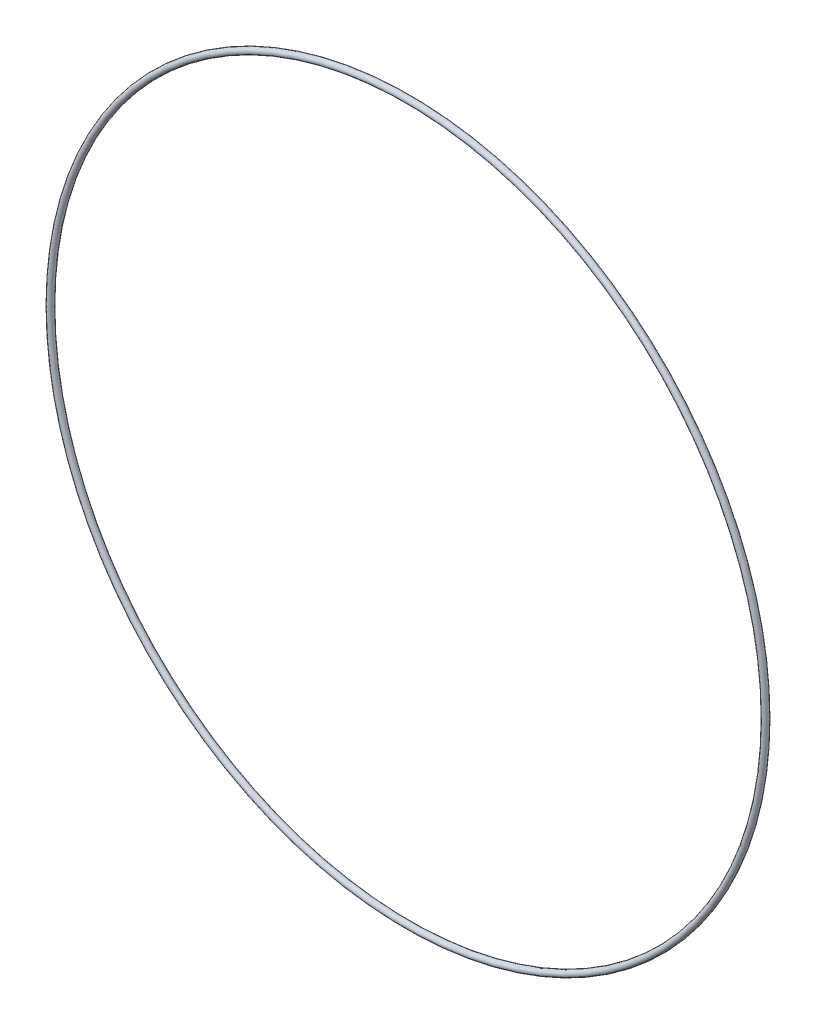
from build123d import *

# Parameters (mm, degrees)
SKETCH6_R = 1


with BuildPart() as part:
    # Sketch6 → Revolve1 (revolve)
    with BuildSketch(Plane(origin=(0, 0, 0), x_dir=(0, 0, -1), z_dir=(1, 0, 0)), mode=Mode.PRIVATE) as revolve1_sk:
        with Locations((0, 114.5)):
            Circle(SKETCH6_R)
    revolve(revolve1_sk.sketch.rotate(Axis((0, 0, 0), (0, 0, -1)), 90), axis=Axis((0, 0, 0), (0, 0, -1)))


solid = part.part
